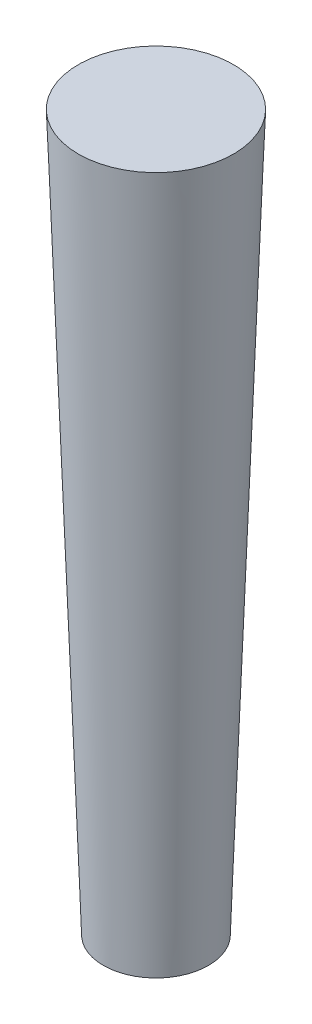
from build123d import *

# Parameters (mm, degrees)
SKETCH1_R           = 2.5
BOSS_EXTRUDE1_DEPTH = 34
BOSS_EXTRUDE1_DRAFT = -2


with BuildPart() as part:
    # Sketch1 → Boss-Extrude1 (with draft: the straight prism first)
    with BuildSketch(Plane(origin=(0, 0, 0), x_dir=(1, 0, 0), z_dir=(0, 1, 0))):
        Circle(SKETCH1_R)
    extrude(amount=BOSS_EXTRUDE1_DEPTH)
    # Boss-Extrude1: the draft: its side faces are tilted about the plane it starts from
    boss_extrude1_sides = [part.faces().sort_by_distance(p)[0] for p in [
        (-2.5, 17, 0),
    ]]
    draft(boss_extrude1_sides, Plane(origin=(0, 0, 0), x_dir=(1, 0, 0), z_dir=(0, 1, 0)), BOSS_EXTRUDE1_DRAFT)


solid = part.part
